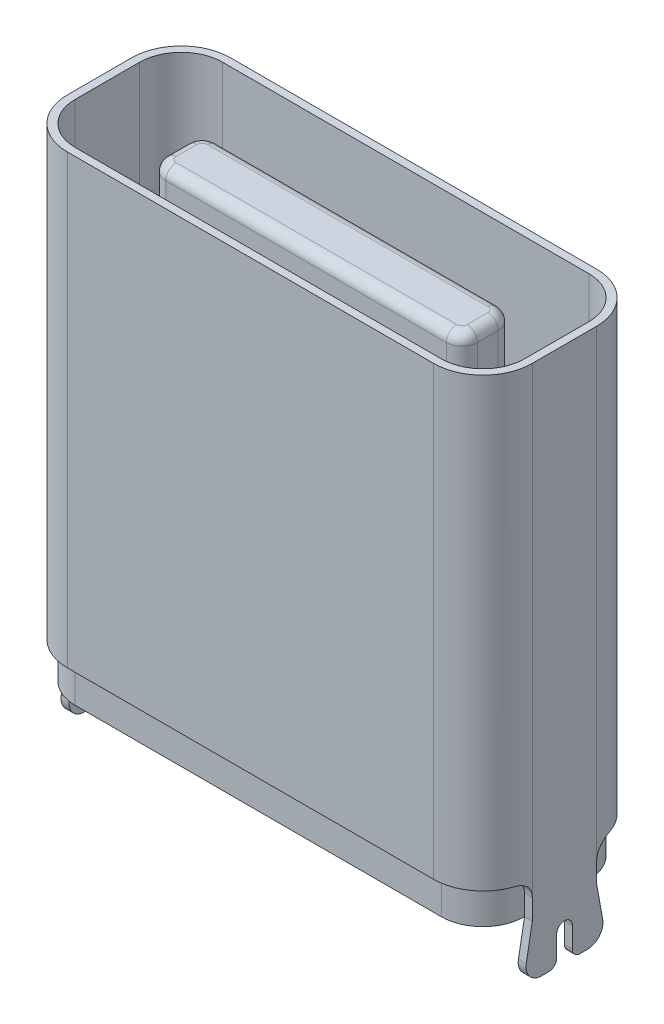
from build123d import *

# Parameters (mm, degrees)
EXTRUDE_1_DEPTH     = 9.3
EXTRUDE_2_DEPTH     = 0.15
EXTRUDE_START       = -0.15
EXTRUDE_3_DEPTH     = 0.15
EXTRUDE_4_DEPTH     = 2
CUT_EXTRUDE_1_DEPTH = 0.7
FILLET_1_R          = 0.3
EXTRUDE_5_DEPTH     = 0.15
CUT_EXTRUDE_2_DEPTH = 0.15
EXTRUDE_6_DEPTH     = 6.9
FILLET_2_R          = 0.2


with BuildPart() as part:
    # 草图1 → 凸台-拉伸1 (new body)
    with BuildSketch(Plane(origin=(0, 0, 0), x_dir=(1, 0, 0), z_dir=(0, 1, 0))):
        with BuildLine():
            Line((0.8, -0.15), (7.85, -0.15))
            ThreePointArc((7.85, -0.15), (8.521751442, 0.128248558), (8.8, 0.8))
            Line((8.8, 0.8), (8.8, 2.04))
            ThreePointArc((8.8, 2.04), (8.521751442, 2.711751442), (7.85, 2.99))
            Line((7.85, 2.99), (0.8, 2.99))
            ThreePointArc((0.8, 2.99), (0.128248558, 2.711751442), (-0.15, 2.04))
            Line((-0.15, 2.04), (-0.15, 0.8))
            ThreePointArc((-0.15, 0.8), (0.128248558, 0.128248558), (0.8, -0.15))
        make_face()
        with BuildLine():
            Line((0.8, 0), (7.85, 0))
            ThreePointArc((7.85, 0), (8.415685425, 0.234314575), (8.65, 0.8))
            Line((8.65, 0.8), (8.65, 2.04))
            ThreePointArc((8.65, 2.04), (8.415685425, 2.605685425), (7.85, 2.84))
            Line((7.85, 2.84), (0.8, 2.84))
            ThreePointArc((0.8, 2.84), (0.234314575, 2.605685425), (0, 2.04))
            Line((0, 2.04), (0, 0.8))
            ThreePointArc((0, 0.8), (0.234314575, 0.234314575), (0.8, 0))
        make_face(mode=Mode.SUBTRACT)
    extrude(amount=EXTRUDE_1_DEPTH)

    # 草图3 → 凸台-拉伸2 (add)
    with BuildSketch(Plane.ZY.offset(0.15)):
        with BuildLine():
            Line((-2.04, 0), (-0.8, 0))
            Line((-0.8, 0), (-0.683566262, -0.646854101))
            ThreePointArc((-0.683566262, -0.646854101), (-0.748665041, -0.892426908), (-0.978821259, -1))
            Line((-0.978821259, -1), (-1.12, -1))
            ThreePointArc((-1.12, -1), (-1.226066017, -0.956066017), (-1.27, -0.85))
            Line((-1.27, -0.85), (-1.27, -0.45))
            ThreePointArc((-1.27, -0.45), (-1.313933983, -0.343933983), (-1.42, -0.3))
            ThreePointArc((-1.42, -0.3), (-1.526066017, -0.343933983), (-1.57, -0.45))
            Line((-1.57, -0.45), (-1.57, -0.85))
            ThreePointArc((-1.57, -0.85), (-1.613933983, -0.956066017), (-1.72, -1))
            Line((-1.72, -1), (-1.861178741, -1))
            ThreePointArc((-1.861178741, -1), (-2.091334959, -0.892426908), (-2.156433738, -0.646854101))
            Line((-2.156433738, -0.646854101), (-2.04, 0))
        make_face()
    extrude(amount=-EXTRUDE_2_DEPTH)

    # 草图4 → 凸台-拉伸3 (add)
    with BuildSketch(Plane(origin=(8.8, 0, 0), x_dir=(0, 0, -1), z_dir=(1, 0, 0)).offset(EXTRUDE_START)):
        with BuildLine():
            Line((0.8, 0), (2.04, 0))
            Line((2.04, 0), (2.156433738, -0.646854101))
            ThreePointArc((2.156433738, -0.646854101), (2.091334959, -0.892426908), (1.861178741, -1))
            Line((1.861178741, -1), (1.72, -1))
            ThreePointArc((1.72, -1), (1.613933983, -0.956066017), (1.57, -0.85))
            Line((1.57, -0.85), (1.57, -0.45))
            ThreePointArc((1.57, -0.45), (1.42, -0.3), (1.27, -0.45))
            Line((1.27, -0.45), (1.27, -0.85))
            ThreePointArc((1.27, -0.85), (1.226066017, -0.956066017), (1.12, -1))
            Line((1.12, -1), (0.978821259, -1))
            ThreePointArc((0.978821259, -1), (0.748665041, -0.892426908), (0.683566262, -0.646854101))
            Line((0.683566262, -0.646854101), (0.8, 0))
        make_face()
    extrude(amount=EXTRUDE_3_DEPTH)

    # 草图5 → 凸台-拉伸4 (add)
    with BuildSketch(Plane.XZ):
        with BuildLine():
            Line((0.8, -2.99), (7.85, -2.99))
            ThreePointArc((7.85, -2.99), (8.521751442, -2.711751442), (8.8, -2.04))
            Line((8.8, -2.04), (8.8, -0.8))
            ThreePointArc((8.8, -0.8), (8.521751442, -0.128248558), (7.85, 0.15))
            Line((7.85, 0.15), (0.8, 0.15))
            ThreePointArc((0.8, 0.15), (0.128248558, -0.128248558), (-0.15, -0.8))
            Line((-0.15, -0.8), (-0.15, -2.04))
            ThreePointArc((-0.15, -2.04), (0.128248558, -2.711751442), (0.8, -2.99))
        make_face()
    extrude(amount=-EXTRUDE_4_DEPTH)

    # 草图6 → 切除-拉伸1 (cut)
    with BuildSketch(Plane.XZ):
        with BuildLine():
            Line((0.8, 0.15), (7.85, 0.15))
            ThreePointArc((7.85, 0.15), (8.521751442, -0.128248558), (8.8, -0.8))
            Line((8.8, -0.8), (8.65, -0.8))
            ThreePointArc((8.65, -0.8), (8.415685425, -0.234314575), (7.85, 0))
            Line((7.85, 0), (0.8, 0))
            ThreePointArc((0.8, 0), (0.234314575, -0.234314575), (0, -0.8))
            Line((0, -0.8), (-0.15, -0.8))
            ThreePointArc((-0.15, -0.8), (0.128248558, -0.128248558), (0.8, 0.15))
        make_face()
        with BuildLine():
            Line((7.85, -2.99), (0.8, -2.99))
            ThreePointArc((0.8, -2.99), (0.128248558, -2.711751442), (-0.15, -2.04))
            Line((-0.15, -2.04), (0, -2.04))
            ThreePointArc((0, -2.04), (0.234314575, -2.605685425), (0.8, -2.84))
            Line((0.8, -2.84), (7.85, -2.84))
            ThreePointArc((7.85, -2.84), (8.415685425, -2.605685425), (8.65, -2.04))
            Line((8.65, -2.04), (8.8, -2.04))
            ThreePointArc((8.8, -2.04), (8.521751442, -2.711751442), (7.85, -2.99))
        make_face()
    extrude(amount=-CUT_EXTRUDE_1_DEPTH, mode=Mode.SUBTRACT)

    # 圆角1
    fillet_1_edges = [part.edges().sort_by_distance(p)[0] for p in [
        (8.725, 0.7, -0.8),
        (-0.075, 0.7, -0.8),
        (-0.075, 0.7, -2.04),
        (8.725, 0.7, -2.04),
    ]]
    fillet(fillet_1_edges, radius=FILLET_1_R)

    # 草图7 → 凸台-拉伸5 (add)
    with BuildSketch(Plane(origin=(0, 0, -2.99), x_dir=(-1, 0, 0), z_dir=(0, 0, -1))):
        with BuildLine():
            Line((-3.225, 0.7), (-5.425, 0.7))
            ThreePointArc((-5.425, 0.7), (-5.071446609, 0.553553391), (-4.925, 0.2))
            Line((-4.925, 0.2), (-4.925, -0.9))
            ThreePointArc((-4.925, -0.9), (-4.837132034, -1.112132034), (-4.625, -1.2))
            Line((-4.625, -1.2), (-4.325, -1.2))
            Line((-4.325, -1.2), (-4.025, -1.2))
            ThreePointArc((-4.025, -1.2), (-3.812867966, -1.112132034), (-3.725, -0.9))
            Line((-3.725, -0.9), (-3.725, 0.2))
            ThreePointArc((-3.725, 0.2), (-3.578553391, 0.553553391), (-3.225, 0.7))
        make_face()
    extrude(amount=-EXTRUDE_5_DEPTH)

    # 草图8 → 切除-拉伸2 (cut)
    with BuildSketch(Plane(origin=(0, 0, -2.99), x_dir=(-1, 0, 0), z_dir=(0, 0, -1))):
        with BuildLine():
            Line((-4.325, -0.9), (-4.125, -0.9))
            ThreePointArc((-4.125, -0.9), (-4.054289322, -0.870710678), (-4.025, -0.8))
            Line((-4.025, -0.8), (-4.025, -0.4))
            ThreePointArc((-4.025, -0.4), (-4.054289322, -0.329289322), (-4.125, -0.3))
            Line((-4.125, -0.3), (-4.525, -0.3))
            ThreePointArc((-4.525, -0.3), (-4.595710678, -0.329289322), (-4.625, -0.4))
            Line((-4.625, -0.4), (-4.625, -0.8))
            ThreePointArc((-4.625, -0.8), (-4.595710678, -0.870710678), (-4.525, -0.9))
            Line((-4.525, -0.9), (-4.325, -0.9))
        make_face()
    extrude(amount=-CUT_EXTRUDE_2_DEPTH, mode=Mode.SUBTRACT)

    # 草图9 → 凸台-拉伸6 (add)
    with BuildSketch(Plane(origin=(0, 2, 0), x_dir=(1, 0, 0), z_dir=(0, 1, 0))):
        with BuildLine():
            Line((1.325, 1.42), (1.325, 1.62))
            ThreePointArc((1.325, 1.62), (1.412867966, 1.832132034), (1.625, 1.92))
            Line((1.625, 1.92), (7.025, 1.92))
            ThreePointArc((7.025, 1.92), (7.237132034, 1.832132034), (7.325, 1.62))
            Line((7.325, 1.62), (7.325, 1.22))
            ThreePointArc((7.325, 1.22), (7.237132034, 1.007867966), (7.025, 0.92))
            Line((7.025, 0.92), (1.625, 0.92))
            ThreePointArc((1.625, 0.92), (1.412867966, 1.007867966), (1.325, 1.22))
            Line((1.325, 1.22), (1.325, 1.42))
        make_face()
    extrude(amount=EXTRUDE_6_DEPTH)

    # 圆角2
    fillet_2_edges = [part.edges().sort_by_distance(p)[0] for p in [
        (7.325, 8.9, -1.42),
        (7.237132034, 8.9, -1.007867966),
        (4.325, 8.9, -0.92),
        (1.412867966, 8.9, -1.007867966),
        (1.325, 8.9, -1.42),
        (1.412867966, 8.9, -1.832132034),
        (4.325, 8.9, -1.92),
        (7.237132034, 8.9, -1.832132034),
    ]]
    fillet(fillet_2_edges, radius=FILLET_2_R)


solid = part.part
